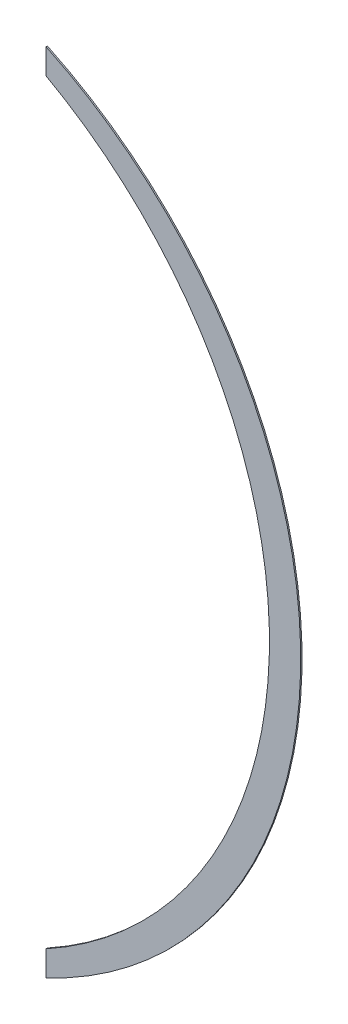
from build123d import *

# Parameters (mm, degrees)
BOSS_EXTRUDE1_DEPTH = 1.5


with BuildPart() as part:
    # Sketch1 → Boss-Extrude1 (new body)
    with BuildSketch(Plane.XY):
        with BuildLine():
            Line((-194.557629783, -430.198761172), (-194.557629783, -401.869451404))
            ThreePointArc((-194.557629783, -401.869451404), (55.477613253, 21.23387169), (-194.557629783, 444.337194783))
            Line((-194.557629783, 444.337194783), (-194.557629783, 472.666504552))
            ThreePointArc((-194.557629783, 472.666504552), (90.480564337, 21.23387169), (-194.557629783, -430.198761172))
        make_face()
    extrude(amount=BOSS_EXTRUDE1_DEPTH)


solid = part.part
